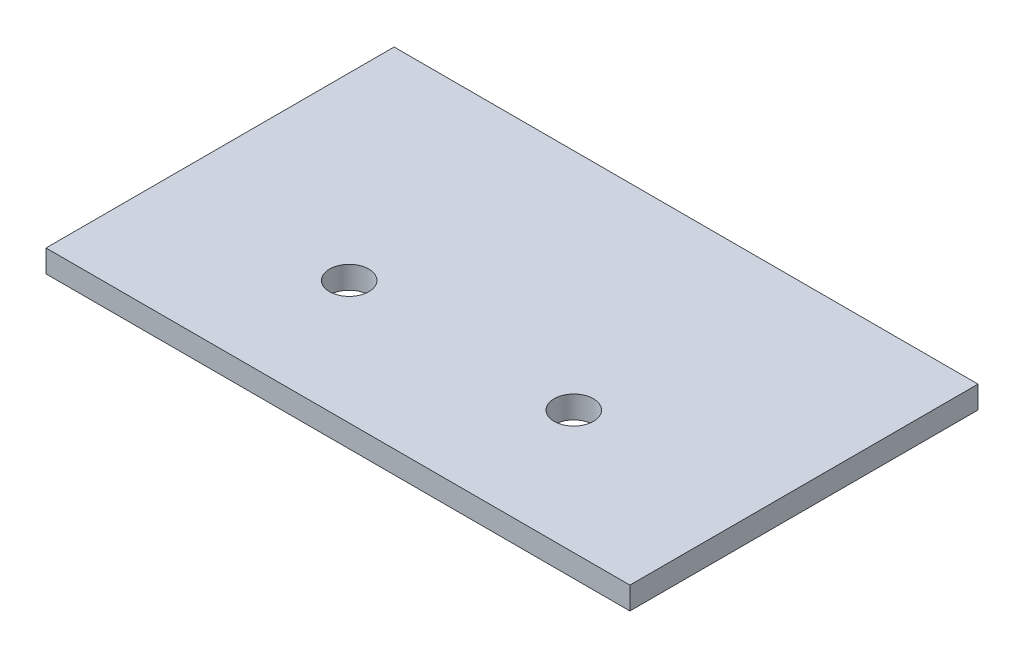
from build123d import *

# Parameters (mm, degrees)
SKETCH1_W           = 52
SKETCH1_H           = 31
SKETCH1_R           = 1.75
BOSS_EXTRUDE1_DEPTH = 2


with BuildPart() as part:
    # Sketch1 → Boss-Extrude1 (new body)
    with BuildSketch(Plane(origin=(0, 0, 0), x_dir=(1, 0, 0), z_dir=(0, 1, 0))):
        Rectangle(SKETCH1_W, SKETCH1_H)
        with Locations(Location((-10, -4.5, 0), (0, 0, 270))):
            Circle(SKETCH1_R, mode=Mode.SUBTRACT)
        with Locations(Location((10, -4.5, 0), (0, 0, 270))):
            Circle(SKETCH1_R, mode=Mode.SUBTRACT)
    extrude(amount=BOSS_EXTRUDE1_DEPTH)


solid = part.part
